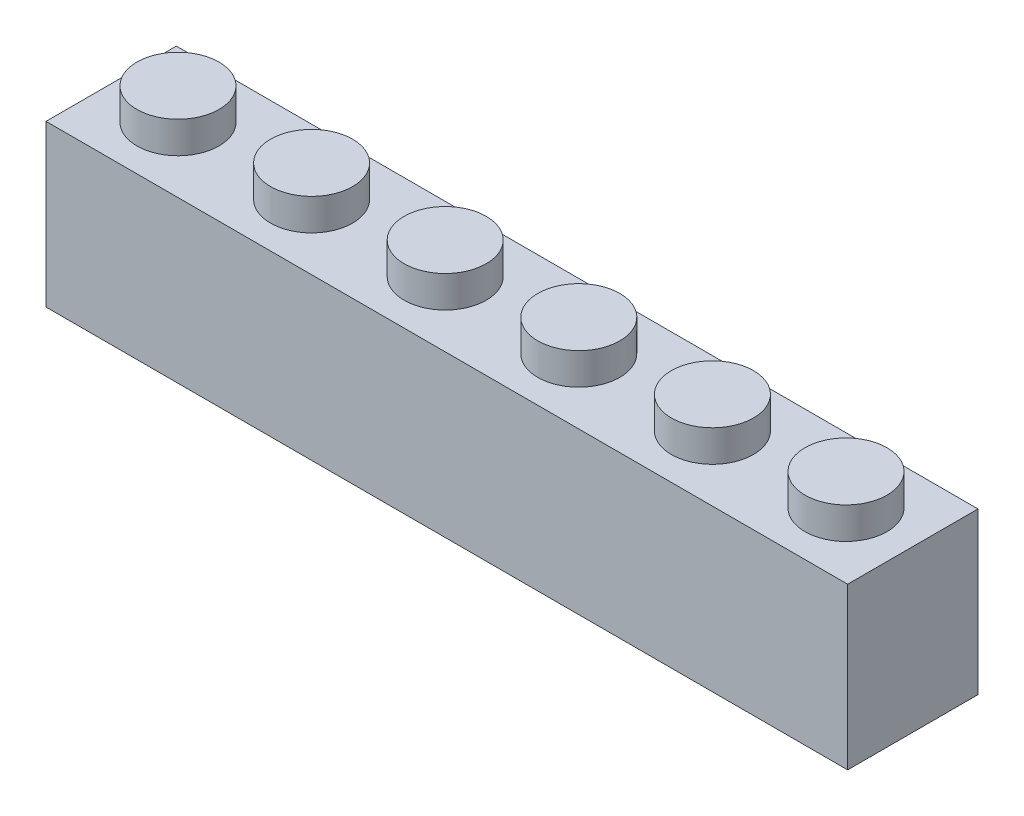
from build123d import *

# Parameters (mm, degrees)
SKETCH1_W           = 47.85
SKETCH1_H           = 9.6
BOSS_EXTRUDE1_DEPTH = 7.78
SKETCH2_R           = 2.45
BOSS_EXTRUDE2_DEPTH = 1.89
SHELL1_T            = -1.5
SKETCH3_R           = 1.48
BOSS_EXTRUDE3_DEPTH = 7.9


with BuildPart() as part:
    # Sketch1 → Boss-Extrude1 (new body)
    with BuildSketch(Plane.XY):
        Rectangle(SKETCH1_W, SKETCH1_H)
    extrude(amount=-BOSS_EXTRUDE1_DEPTH)

    # Sketch2 → Boss-Extrude2 (add)
    with BuildSketch(Plane(origin=(0, 4.8, 0), x_dir=(1, 0, 0), z_dir=(0, 1, 0))):
        with Locations(Location((-19.9375, 3.89, 0), (0, 0, 90))):
            Circle(SKETCH2_R)
        with Locations(Location((-11.9625, 3.89, 0), (0, 0, 90))):
            Circle(SKETCH2_R)
        with Locations(Location((-3.9875, 3.89, 0), (0, 0, 90))):
            Circle(SKETCH2_R)
        with Locations(Location((3.9875, 3.89, 0), (0, 0, 90))):
            Circle(SKETCH2_R)
        with Locations(Location((11.9625, 3.89, 0), (0, 0, 90))):
            Circle(SKETCH2_R)
        with Locations(Location((19.9375, 3.89, 0), (0, 0, 90))):
            Circle(SKETCH2_R)
    extrude(amount=BOSS_EXTRUDE2_DEPTH)

    # Shell1
    shell1_openings = [part.faces().sort_by_distance(p)[0] for p in [
        (0, -4.8, -3.89),
    ]]
    offset(amount=SHELL1_T, openings=shell1_openings, kind=Kind.INTERSECTION)

    # Sketch3 → Boss-Extrude3 (add)
    with BuildSketch(Plane.XZ.offset(-3.3)):
        with Locations(Location((-15.95, -3.89, 0), (0, 0, 90))):
            Circle(SKETCH3_R)
        with Locations(Location((-7.975, -3.89, 0), (0, 0, 90))):
            Circle(SKETCH3_R)
        with Locations(Location((0, -3.89, 0), (0, 0, 90))):
            Circle(SKETCH3_R)
        with Locations(Location((7.975, -3.89, 0), (0, 0, 90))):
            Circle(SKETCH3_R)
        with Locations(Location((15.95, -3.89, 0), (0, 0, 90))):
            Circle(SKETCH3_R)
    extrude(amount=BOSS_EXTRUDE3_DEPTH)


solid = part.part
